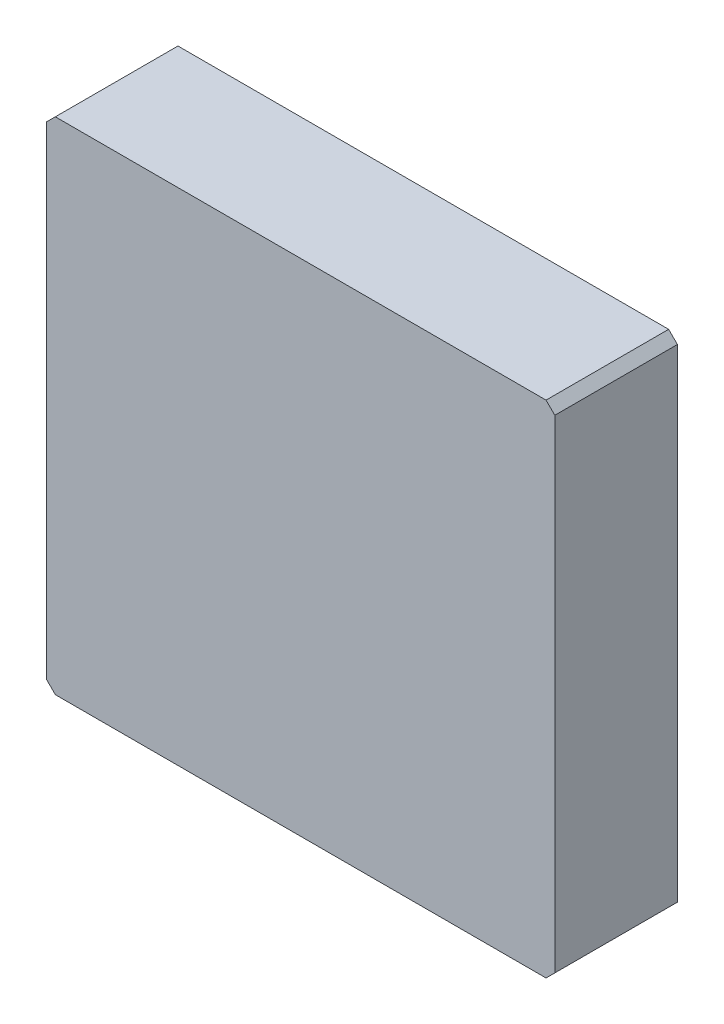
from build123d import *

# Parameters (mm, degrees)
BOSS_EXTRUDE1_DEPTH = 49.784
CUT_EXTRUDE1_DEPTH  = 31.877


with BuildPart() as part:
    # Sketch1 → Boss-Extrude1 (new body)
    with BuildSketch(Plane.XY):
        Polygon((0, 199.644), (3.556, 203.2), (202.7936, 203.2), (206.3496, 199.644), (206.3496, 3.556), (202.7936, 0), (3.556, 0), (0, 3.556), align=None)
    extrude(amount=BOSS_EXTRUDE1_DEPTH)

    # Sketch2 → Cut-Extrude1 (cut)
    with BuildSketch(Plane(origin=(0, 0, 0), x_dir=(-1, 0, 0), z_dir=(0, 0, -1))):
        with BuildLine():
            Line((-192.8876, 181.8386), (-192.8876, 21.3614))
            ThreePointArc((-192.8876, 21.3614), (-190.49952443, 15.59607557), (-184.7342, 13.208))
            Line((-184.7342, 13.208), (-65.913, 13.208))
            ThreePointArc((-65.913, 13.208), (-60.14767557, 15.59607557), (-57.7596, 21.3614))
            Line((-57.7596, 21.3614), (-57.7596, 100.076))
            Line((-57.7596, 100.076), (-54.2036, 103.632))
            Line((-54.2036, 103.632), (-21.3614, 103.632))
            ThreePointArc((-21.3614, 103.632), (-15.59607557, 106.02007557), (-13.208, 111.7854))
            Line((-13.208, 111.7854), (-13.208, 181.8386))
            ThreePointArc((-13.208, 181.8386), (-15.59607557, 187.60392443), (-21.3614, 189.992))
            Line((-21.3614, 189.992), (-184.7342, 189.992))
            ThreePointArc((-184.7342, 189.992), (-190.49952443, 187.60392443), (-192.8876, 181.8386))
        make_face()
    extrude(amount=-CUT_EXTRUDE1_DEPTH, mode=Mode.SUBTRACT)


solid = part.part
